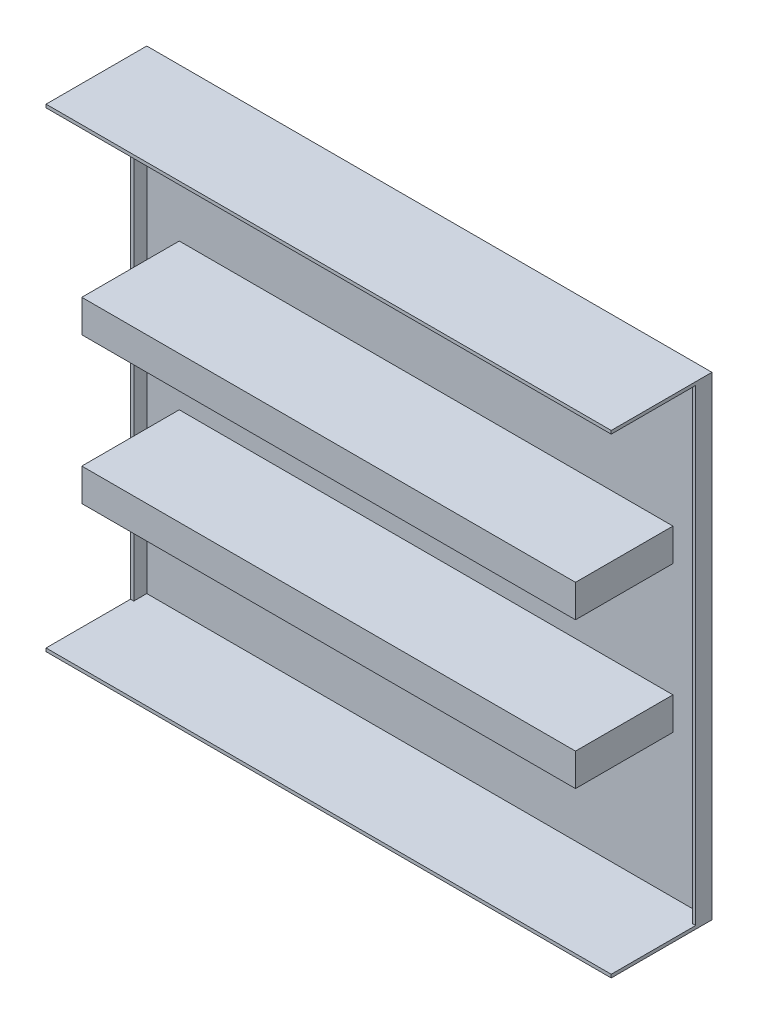
from build123d import *

# Parameters (mm, degrees)
SZKIC1_W                    = 172
SZKIC1_H                    = 144
DODANIE_WYCI_GNI_CIE1_DEPTH = 1
SZKIC1_3_W                  = 174
SZKIC1_3_H                  = 146
SZKIC1_3_W_2                = 172
SZKIC1_3_H_2                = 144
DODANIE_WYCI_GNI_CIE2_DEPTH = 5
SZKIC2_W                    = 152
SZKIC2_H                    = 10
DODANIE_WYCI_GNI_CIE4_DEPTH = 30
SZKIC4_W                    = 174
SZKIC4_H                    = 1
DODANIE_WYCI_GNI_CIE5_DEPTH = 26


with BuildPart() as part:
    # Szkic1 → Dodanie-wyciągnięcie1 (new body)
    with BuildSketch(Plane.XY):
        with Locations((86, 72)):
            Rectangle(SZKIC1_W, SZKIC1_H)
    extrude(amount=DODANIE_WYCI_GNI_CIE1_DEPTH)

    # Szkic1<3> → Dodanie-wyciągnięcie2 (add)
    with BuildSketch(Plane.XY):
        with Locations((86, 72)):
            Rectangle(SZKIC1_3_W, SZKIC1_3_H)
        with Locations((86, 72)):
            Rectangle(SZKIC1_3_W_2, SZKIC1_3_H_2, mode=Mode.SUBTRACT)
    extrude(amount=DODANIE_WYCI_GNI_CIE2_DEPTH)

    # Szkic2 → Dodanie-wyciągnięcie4 (add)
    with BuildSketch(Plane.XY.offset(1)):
        with Locations((86, 49)):
            Rectangle(SZKIC2_W, SZKIC2_H)
        with Locations((86, 94)):
            Rectangle(SZKIC2_W, SZKIC2_H)
    extrude(amount=DODANIE_WYCI_GNI_CIE4_DEPTH)

    # Szkic4 → Dodanie-wyciągnięcie5 (add)
    with BuildSketch(Plane.XY.offset(5)):
        with Locations((86, -0.5)):
            Rectangle(SZKIC4_W, SZKIC4_H)
        with Locations((86, 144.5)):
            Rectangle(SZKIC4_W, SZKIC4_H)
    extrude(amount=DODANIE_WYCI_GNI_CIE5_DEPTH)


solid = part.part
